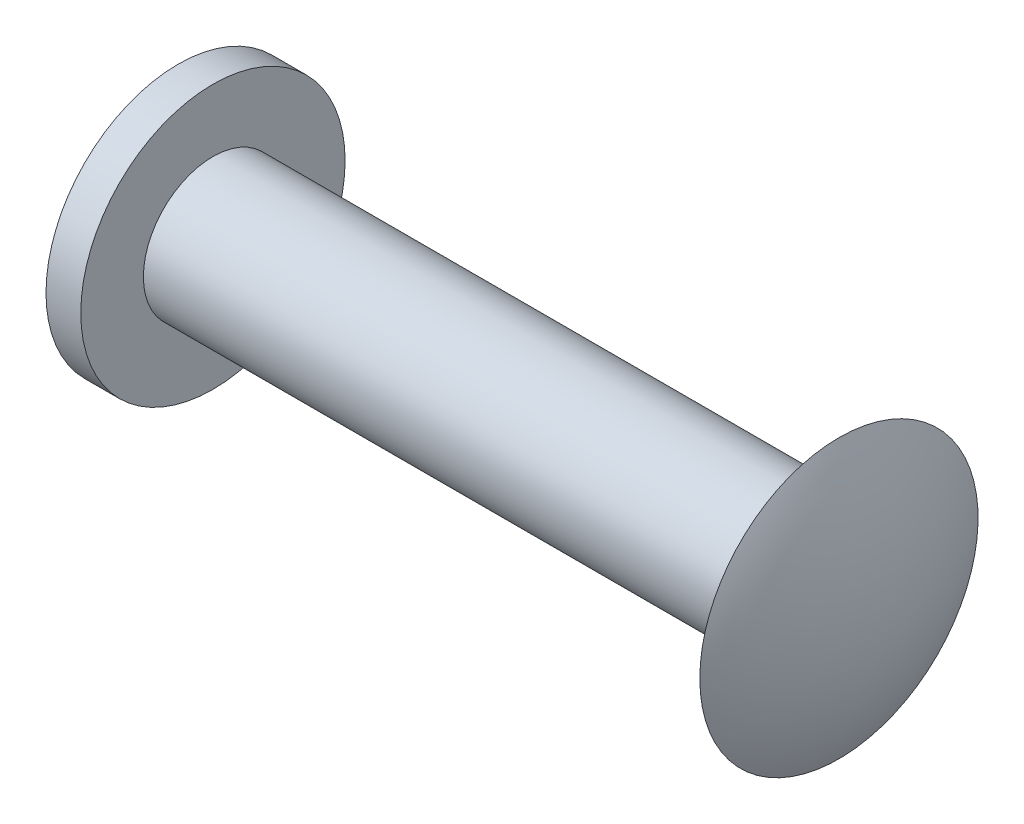
from build123d import *


with BuildPart() as part:
    # Szkic1 → Obrót1 (revolve)
    with BuildSketch(Plane.XY, mode=Mode.PRIVATE) as obr_t1_sk:
        with BuildLine():
            Line((0, 0), (9.5, 0))
            Line((9.5, 0), (10, 0))
            ThreePointArc((10, 0), (9.873105626, 1.030776406), (9.5, 2))
            Line((9.5, 2), (9.5, 1))
            Line((9.5, 1), (0.5, 1))
            Line((0.5, 1), (0.5, 1.9))
            Line((0.5, 1.9), (0, 1.9))
            Line((0, 1.9), (0, 0))
        make_face()
    revolve(obr_t1_sk.sketch.rotate(Axis((9.5, 0, 0), (1, 0, 0)), 90), axis=Axis((9.5, 0, 0), (1, 0, 0)))


solid = part.part
